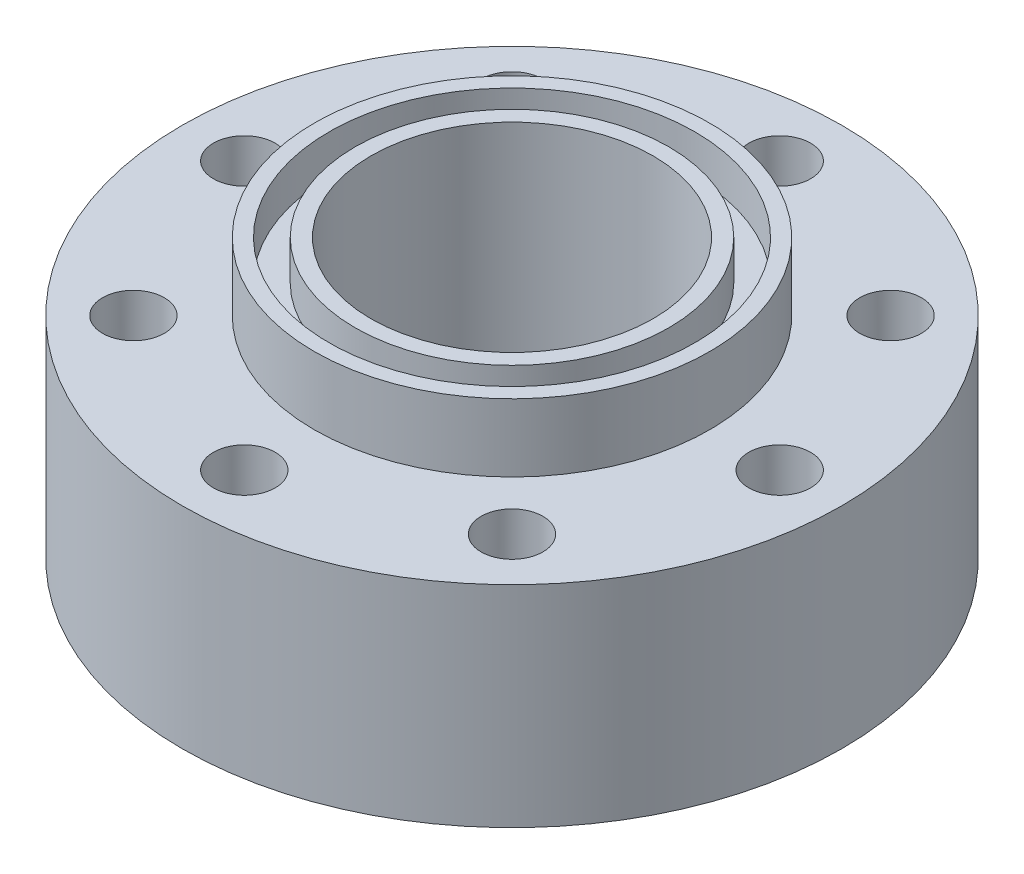
from build123d import *

# Parameters (mm, degrees)
IZIM3_R                    = 9.390363547
KES_EKSTR_ZYON1_DEPTH      = 189.544918963
KES_EKSTR_ZYON1_DEPTH_BACK = 189.544918963
IZIM7_R                    = 11.718085775
KES_EKSTR_ZYON2_DEPTH      = 189.544918963
KES_EKSTR_ZYON2_DEPTH_BACK = 189.544918963
IZIM8_R                    = 53.49941146
KES_EKSTR_ZYON3_DEPTH      = 206.841349534
KES_EKSTR_ZYON3_DEPTH_BACK = 15
IZIM9_R                    = 69.318173785
IZIM9_R_2                  = 59.453779196


with BuildPart() as part:
    # Çizim2 → Döndür1 (revolve)
    with BuildSketch(Plane.XY, mode=Mode.PRIVATE) as d_nd_r1_sk:
        Polygon((0, -39.886363636), (125, -39.886363636), (125, 39.886363636), (75, 39.886363636), (75, 65.568181818), (0, 65.568181818), align=None)
    revolve(d_nd_r1_sk.sketch.rotate(Axis((0, 65.568181818, 0), (0, -1, 0)), 90), axis=Axis((0, 65.568181818, 0), (0, -1, 0)))

    # Çizim3 → Kes-Döndür1 (revolve, cut)
    with BuildSketch(Plane.XY, mode=Mode.PRIVATE) as kes_d_nd_r1_sk:
        with Locations((99.895822134, 0)):
            Circle(IZIM3_R)
    revolve(kes_d_nd_r1_sk.sketch.rotate(Axis((0, 65.568181818, 0), (0, 1, 0)), 90), axis=Axis((0, 65.568181818, 0), (0, 1, 0)), mode=Mode.SUBTRACT)

    # Çizim7 → Kes-Ekstrüzyon1 (cut, two sides: drawn at the far end of the back side and taken through both)
    with BuildSketch(Plane(origin=(0, 0, 0), x_dir=(1, 0, 0), z_dir=(0, 1, 0)).offset(-KES_EKSTR_ZYON1_DEPTH_BACK)):
        with Locations(Location((0, 101.493742921, 0), (0, 0, 270))):
            Circle(IZIM7_R)
        with Locations(Location((71.766913868, 71.766913868, 0), (0, 0, 270))):
            Circle(IZIM7_R)
        with Locations(Location((101.493742921, 0, 0), (0, 0, 270))):
            Circle(IZIM7_R)
        with Locations(Location((71.766913868, -71.766913868, 0), (0, 0, 270))):
            Circle(IZIM7_R)
        with Locations(Location((0, -101.493742921, 0), (0, 0, 270))):
            Circle(IZIM7_R)
        with Locations(Location((-71.766913868, -71.766913868, 0), (0, 0, 270))):
            Circle(IZIM7_R)
        with Locations(Location((-101.493742921, 0, 0), (0, 0, 270))):
            Circle(IZIM7_R)
        with Locations(Location((-71.766913868, 71.766913868, 0), (0, 0, 270))):
            Circle(IZIM7_R)
    extrude(amount=KES_EKSTR_ZYON1_DEPTH + KES_EKSTR_ZYON1_DEPTH_BACK, mode=Mode.SUBTRACT)

    # Çizim8 → Kes-Ekstrüzyon2 (cut, two sides: drawn at the far end of the back side and taken through both)
    with BuildSketch(Plane(origin=(0, 0, 0), x_dir=(1, 0, 0), z_dir=(0, 1, 0)).offset(-KES_EKSTR_ZYON2_DEPTH_BACK)):
        with Locations(Location((0, 0, 0), (0, 0, 270))):
            Circle(IZIM8_R)
    extrude(amount=KES_EKSTR_ZYON2_DEPTH + KES_EKSTR_ZYON2_DEPTH_BACK, mode=Mode.SUBTRACT)

    # Çizim9 → Kes-Ekstrüzyon3 (cut, two sides: drawn at the far end of the back side and taken through both)
    with BuildSketch(Plane(origin=(0, 65.568181818, 0), x_dir=(1, 0, 0), z_dir=(0, 1, 0)).offset(-KES_EKSTR_ZYON3_DEPTH_BACK)):
        with Locations(Location((0, 0, 0), (0, 0, 90))):
            Circle(IZIM9_R)
        with Locations(Location((0, 0, 0), (0, 0, 90))):
            Circle(IZIM9_R_2, mode=Mode.SUBTRACT)
    extrude(amount=KES_EKSTR_ZYON3_DEPTH + KES_EKSTR_ZYON3_DEPTH_BACK, mode=Mode.SUBTRACT)


solid = part.part
